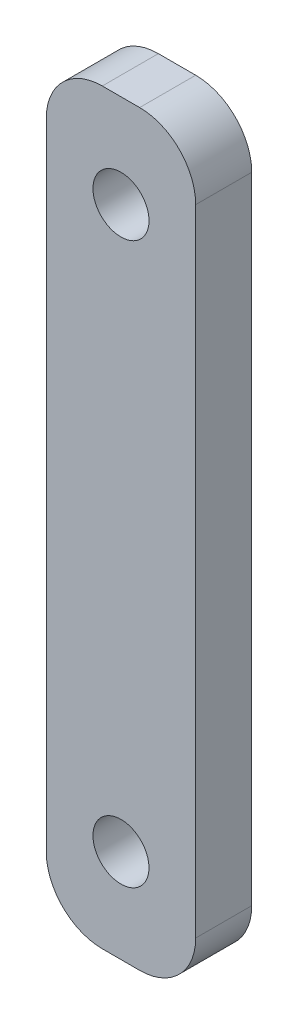
from build123d import *

# Parameters (mm, degrees)
CROQUIS1_R              = 1.5
SALIENTE_EXTRUIR1_DEPTH = 1.5


with BuildPart() as part:
    # Croquis1 → Saliente-Extruir1 (new, symmetric)
    with BuildSketch(Plane.XY):
        with BuildLine():
            Line((-1, -20), (1, -20))
            ThreePointArc((1, -20), (3.121320344, -19.121320344), (4, -17))
            Line((4, -17), (4, 17))
            ThreePointArc((4, 17), (3.121320344, 19.121320344), (1, 20))
            Line((1, 20), (-1, 20))
            ThreePointArc((-1, 20), (-3.121320344, 19.121320344), (-4, 17))
            Line((-4, 17), (-4, -17))
            ThreePointArc((-4, -17), (-3.121320344, -19.121320344), (-1, -20))
        make_face()
        with Locations((0, 15)):
            Circle(CROQUIS1_R, mode=Mode.SUBTRACT)
        with Locations(Location((0, -15, 0), (0, 0, 180))):
            Circle(CROQUIS1_R, mode=Mode.SUBTRACT)
    extrude(amount=SALIENTE_EXTRUIR1_DEPTH, both=True)


solid = part.part
